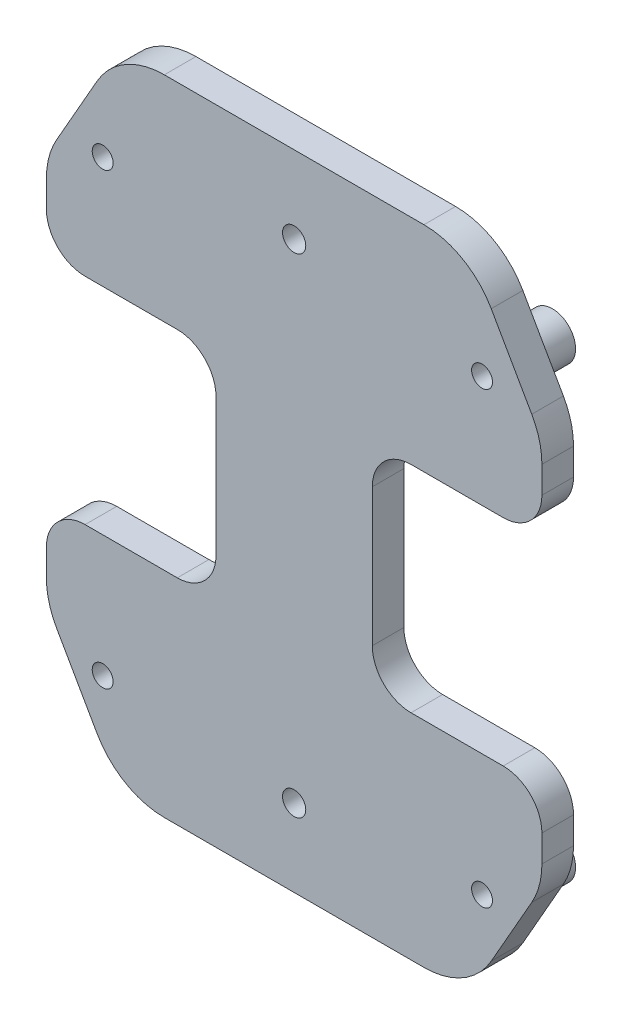
from build123d import *

# Parameters (mm, degrees)
IZIM1_R                     = 1.5
IZIM1_R_2                   = 1.275
Y_KSEKLIK_EKSTR_ZYON1_DEPTH = 8
IZIM2_R                     = 4
KES_EKSTR_ZYON1_DEPTH       = 5
IZIM3_R                     = 3.5
KES_EKSTR_ZYON2_DEPTH       = 5
IZIM5_W                     = 11.833700998
IZIM5_H                     = 5.687133077
Y_KSEKLIK_EKSTR_ZYON2_DEPTH = 55
IZIM6_R                     = 1.5
KES_EKSTR_ZYON3_DEPTH       = 70
Y_KSEKLIK_EKSTR_ZYON3_DEPTH = 10
KES_EKSTR_ZYON4_START       = -10
IZIM8_R                     = 1.5
KES_EKSTR_ZYON4_DEPTH       = 10
IZIM9_W                     = 97.77314617
IZIM9_H                     = 81.30293778
KES_EKSTR_ZYON5_DEPTH       = 94.5
IZIM10_R                    = 3
IZIM10_R_2                  = 1.35
Y_KSEKLIK_EKSTR_ZYON4_DEPTH = 5
IZIM12_R                    = 1.35
KES_EKSTR_ZYON6_DEPTH       = 11.5


with BuildPart() as part:
    # Çizim1 → Yükseklik-Ekstrüzyon1 (new body)
    with BuildSketch(Plane.XY):
        with BuildLine():
            Line((-26.942326891, 14.769848309), (-15.036455376, 14.769848309))
            ThreePointArc((-15.036455376, 14.769848309), (-11.50092147, 13.305382214), (-10.036455376, 9.769848309))
            Line((-10.036455376, 9.769848309), (-10.036455376, -8.006371062))
            ThreePointArc((-10.036455376, -8.006371062), (-11.50092147, -11.541904968), (-15.036455376, -13.006371062))
            Line((-15.036455376, -13.006371062), (-26.942326891, -13.006371062))
            ThreePointArc((-26.942326891, -13.006371062), (-30.477860797, -14.470837156), (-31.942326891, -18.006371062))
            Line((-31.942326891, -18.006371062), (-31.942326891, -21.470074229))
            ThreePointArc((-31.942326891, -21.470074229), (-31.6091093, -24.030019123), (-30.63166332, -26.419360282))
            Line((-30.63166332, -26.419360282), (-25.398075072, -35.607838889))
            ThreePointArc((-25.398075072, -35.607838889), (-21.734031643, -39.304154624), (-16.708738643, -40.658552836))
            Line((-16.708738643, -40.658552836), (16.824084861, -40.658552836))
            ThreePointArc((16.824084861, -40.658552836), (21.849377861, -39.304154624), (25.513421289, -35.607838889))
            Line((25.513421289, -35.607838889), (30.747009537, -26.419360282))
            ThreePointArc((30.747009537, -26.419360282), (31.724455518, -24.030019123), (32.057673109, -21.470074229))
            Line((32.057673109, -21.470074229), (32.057673109, -18.006371062))
            ThreePointArc((32.057673109, -18.006371062), (30.593207015, -14.470837156), (27.057673109, -13.006371062))
            Line((27.057673109, -13.006371062), (15.151801594, -13.006371062))
            ThreePointArc((15.151801594, -13.006371062), (11.616267688, -11.541904968), (10.151801594, -8.006371062))
            Line((10.151801594, -8.006371062), (10.151801594, 9.769848309))
            ThreePointArc((10.151801594, 9.769848309), (11.616267688, 13.305382214), (15.151801594, 14.769848309))
            Line((15.151801594, 14.769848309), (27.057673109, 14.769848309))
            ThreePointArc((27.057673109, 14.769848309), (30.593207015, 16.234314403), (32.057673109, 19.769848309))
            Line((32.057673109, 19.769848309), (32.057673109, 23.233551476))
            ThreePointArc((32.057673109, 23.233551476), (31.724455518, 25.793496369), (30.747009537, 28.182837528))
            Line((30.747009537, 28.182837528), (25.513421289, 37.371316135))
            ThreePointArc((25.513421289, 37.371316135), (21.849377861, 41.06763187), (16.824084861, 42.422030083))
            Line((16.824084861, 42.422030083), (-16.708738643, 42.422030083))
            ThreePointArc((-16.708738643, 42.422030083), (-21.734031643, 41.06763187), (-25.398075072, 37.371316135))
            Line((-25.398075072, 37.371316135), (-30.63166332, 28.182837528))
            ThreePointArc((-30.63166332, 28.182837528), (-31.6091093, 25.793496369), (-31.942326891, 23.233551476))
            Line((-31.942326891, 23.233551476), (-31.942326891, 19.769848309))
            ThreePointArc((-31.942326891, 19.769848309), (-30.477860797, 16.234314403), (-26.942326891, 14.769848309))
        make_face()
        with Locations((20.284256069, 32.422030083)):
            Circle(IZIM1_R, mode=Mode.SUBTRACT)
        with Locations((-20.168909852, 32.422030083)):
            Circle(IZIM1_R, mode=Mode.SUBTRACT)
        with Locations((-20.168909852, -30.658552836)):
            Circle(IZIM1_R, mode=Mode.SUBTRACT)
        with Locations((20.284256069, -30.658552836)):
            Circle(IZIM1_R, mode=Mode.SUBTRACT)
        with Locations((22.057673109, -21.118261377)):
            Circle(IZIM1_R_2, mode=Mode.SUBTRACT)
        with Locations((-21.942326891, -21.118261377)):
            Circle(IZIM1_R_2, mode=Mode.SUBTRACT)
        with Locations((22.057673109, 22.881738623)):
            Circle(IZIM1_R_2, mode=Mode.SUBTRACT)
        with Locations((-21.942326891, 22.881738623)):
            Circle(IZIM1_R_2, mode=Mode.SUBTRACT)
        with Locations((0.057673109, 32.422030083)):
            Circle(IZIM1_R, mode=Mode.SUBTRACT)
        with Locations(Location((0.057673109, -30.658552836, 0), (0, 0, 180))):
            Circle(IZIM1_R, mode=Mode.SUBTRACT)
    extrude(amount=Y_KSEKLIK_EKSTR_ZYON1_DEPTH)

    # Çizim2 → Kes-Ekstrüzyon1 (cut)
    with BuildSketch(Plane(origin=(0, 0, 0), x_dir=(-1, 0, 0), z_dir=(0, 0, -1))):
        with Locations((-22.057673109, 22.881738623)):
            Circle(IZIM2_R)
        with Locations((21.942326891, 22.881738623)):
            Circle(IZIM2_R)
        with Locations((-22.057673109, -21.118261377)):
            Circle(IZIM2_R)
        with Locations((21.942326891, -21.118261377)):
            Circle(IZIM2_R)
        with Locations((-0.057673109, 32.422030083)):
            Circle(IZIM2_R)
        with Locations((-0.057673109, -30.658552836)):
            Circle(IZIM2_R)
    extrude(amount=-KES_EKSTR_ZYON1_DEPTH, mode=Mode.SUBTRACT)

    # Çizim3 → Kes-Ekstrüzyon2 (cut)
    with BuildSketch(Plane.XY.offset(8)):
        with Locations((-20.168909852, 32.422030083)):
            Circle(IZIM3_R)
        with Locations((20.284256069, 32.422030083)):
            Circle(IZIM3_R)
        with Locations((20.284256069, -30.658552836)):
            Circle(IZIM3_R)
        with Locations((-20.168909852, -30.658552836)):
            Circle(IZIM3_R)
    extrude(amount=-KES_EKSTR_ZYON2_DEPTH, mode=Mode.SUBTRACT)

    # Çizim5 → Yükseklik-Ekstrüzyon2 (add)
    with BuildSketch(Plane.XY.offset(8)):
        with Locations((0.057673109, 32.422030083)):
            Rectangle(IZIM5_W, IZIM5_H)
        with Locations((0.057673109, -30.658552837)):
            Rectangle(IZIM5_W, IZIM5_H)
    extrude(amount=Y_KSEKLIK_EKSTR_ZYON2_DEPTH)

    # Çizim6 → Kes-Ekstrüzyon3 (cut)
    with BuildSketch(Plane(origin=(0, 0, 8), x_dir=(-1, 0, 0), z_dir=(0, 0, -1))):
        with Locations((-0.057673109, -30.658552836)):
            Circle(IZIM6_R)
        with Locations((-0.057673109, 32.422030083)):
            Circle(IZIM6_R)
    extrude(amount=-KES_EKSTR_ZYON3_DEPTH, mode=Mode.SUBTRACT)

    # Çizim7 → Yükseklik-Ekstrüzyon3 (add)
    with BuildSketch(Plane.XY.offset(63)):
        with BuildLine():
            Line((-31.942326891, 23.233551476), (-31.942326891, 19.769848309))
            ThreePointArc((-31.942326891, 19.769848309), (-30.477860797, 16.234314403), (-26.942326891, 14.769848309))
            Line((-26.942326891, 14.769848309), (-15.036455376, 14.769848309))
            ThreePointArc((-15.036455376, 14.769848309), (-11.50092147, 13.305382214), (-10.036455376, 9.769848309))
            Line((-10.036455376, 9.769848309), (-10.036455376, -8.006371062))
            ThreePointArc((-10.036455376, -8.006371062), (-11.50092147, -11.541904968), (-15.036455376, -13.006371062))
            Line((-15.036455376, -13.006371062), (-26.942326891, -13.006371062))
            ThreePointArc((-26.942326891, -13.006371062), (-30.477860797, -14.470837156), (-31.942326891, -18.006371062))
            Line((-31.942326891, -18.006371062), (-31.942326891, -21.470074229))
            ThreePointArc((-31.942326891, -21.470074229), (-31.6091093, -24.030019123), (-30.63166332, -26.419360282))
            Line((-30.63166332, -26.419360282), (-25.398075072, -35.607838889))
            ThreePointArc((-25.398075072, -35.607838889), (-21.734031643, -39.304154624), (-16.708738643, -40.658552836))
            Line((-16.708738643, -40.658552836), (16.824084861, -40.658552836))
            ThreePointArc((16.824084861, -40.658552836), (21.849377861, -39.304154624), (25.513421289, -35.607838889))
            Line((25.513421289, -35.607838889), (30.747009537, -26.419360282))
            ThreePointArc((30.747009537, -26.419360282), (31.724455518, -24.030019123), (32.057673109, -21.470074229))
            Line((32.057673109, -21.470074229), (32.057673109, -18.006371062))
            ThreePointArc((32.057673109, -18.006371062), (30.593207015, -14.470837156), (27.057673109, -13.006371062))
            Line((27.057673109, -13.006371062), (15.151801594, -13.006371062))
            ThreePointArc((15.151801594, -13.006371062), (11.616267688, -11.541904968), (10.151801594, -8.006371062))
            Line((10.151801594, -8.006371062), (10.151801594, 9.769848309))
            ThreePointArc((10.151801594, 9.769848309), (11.616267688, 13.305382214), (15.151801594, 14.769848309))
            Line((15.151801594, 14.769848309), (27.057673109, 14.769848309))
            ThreePointArc((27.057673109, 14.769848309), (30.593207015, 16.234314403), (32.057673109, 19.769848309))
            Line((32.057673109, 19.769848309), (32.057673109, 23.233551476))
            ThreePointArc((32.057673109, 23.233551476), (31.724455518, 25.793496369), (30.747009537, 28.182837528))
            Line((30.747009537, 28.182837528), (25.513421289, 37.371316135))
            ThreePointArc((25.513421289, 37.371316135), (21.849377861, 41.06763187), (16.824084861, 42.422030083))
            Line((16.824084861, 42.422030083), (-16.708738643, 42.422030083))
            ThreePointArc((-16.708738643, 42.422030083), (-21.734031643, 41.06763187), (-25.398075072, 37.371316135))
            Line((-25.398075072, 37.371316135), (-30.63166332, 28.182837528))
            ThreePointArc((-30.63166332, 28.182837528), (-31.6091093, 25.793496369), (-31.942326891, 23.233551476))
        make_face()
    extrude(amount=Y_KSEKLIK_EKSTR_ZYON3_DEPTH)

    # Çizim8 → Kes-Ekstrüzyon4 (cut)
    with BuildSketch(Plane.XY.offset(73).offset(KES_EKSTR_ZYON4_START)):
        with Locations(Location((0.057673109, -30.658552836, 0), (0, 0, 180))):
            Circle(IZIM8_R)
        with Locations(Location((0.057673109, 32.422030083, 0), (0, 0, 180))):
            Circle(IZIM8_R)
    extrude(amount=KES_EKSTR_ZYON4_DEPTH, mode=Mode.SUBTRACT)

    # Çizim9 → Kes-Ekstrüzyon5 (cut, symmetric)
    with BuildSketch(Plane(origin=(0, 35.265596621, 0), x_dir=(1, 0, 0), z_dir=(0, 1, 0))):
        with Locations((-4.059878989, -28.264895805)):
            Rectangle(IZIM9_W, IZIM9_H)
    extrude(amount=KES_EKSTR_ZYON5_DEPTH, both=True, mode=Mode.SUBTRACT)

    # Çizim10 → Yükseklik-Ekstrüzyon4 (add)
    # profile 1 of 4: a face of its own
    with BuildSketch(Plane(origin=(0, 0, 68.916364695), x_dir=(-1, 0, 0), z_dir=(0, 0, -1))):
        with Locations(Location((24.673182088, -28.763886305, 0), (0, 0, 180))):
            Circle(IZIM10_R)
        with Locations((24.673182088, -28.763886305)):
            Circle(IZIM10_R_2, mode=Mode.SUBTRACT)
    # profile 2 of 4: a face of its own
    with BuildSketch(Plane(origin=(0, 0, 68.916364695), x_dir=(-1, 0, 0), z_dir=(0, 0, -1))):
        with Locations(Location((-24.326817912, -28.763886305, 0), (0, 0, 180))):
            Circle(IZIM10_R)
        with Locations((-24.326817912, -28.763886305)):
            Circle(IZIM10_R_2, mode=Mode.SUBTRACT)
    # profile 3 of 4: a face of its own
    with BuildSketch(Plane(origin=(0, 0, 68.916364695), x_dir=(-1, 0, 0), z_dir=(0, 0, -1))):
        with Locations(Location((-24.326817912, 29.236113695, 0), (0, 0, 180))):
            Circle(IZIM10_R)
        with Locations((-24.326817912, 29.236113695)):
            Circle(IZIM10_R_2, mode=Mode.SUBTRACT)
    # profile 4 of 4: a face of its own
    with BuildSketch(Plane(origin=(0, 0, 68.916364695), x_dir=(-1, 0, 0), z_dir=(0, 0, -1))):
        with Locations(Location((24.673182088, 29.236113695, 0), (0, 0, 180))):
            Circle(IZIM10_R)
        with Locations((24.673182088, 29.236113695)):
            Circle(IZIM10_R_2, mode=Mode.SUBTRACT)
    extrude(amount=Y_KSEKLIK_EKSTR_ZYON4_DEPTH)

    # Çizim12 → Kes-Ekstrüzyon6 (cut, symmetric)
    with BuildSketch(Plane(origin=(0, 0, 68.916364695), x_dir=(-1, 0, 0), z_dir=(0, 0, -1))):
        with Locations(Location((-24.326817912, -28.763886305, 0), (0, 0, 180))):
            Circle(IZIM12_R)
        with Locations(Location((24.673182088, -28.763886305, 0), (0, 0, 180))):
            Circle(IZIM12_R)
        with Locations(Location((24.673182088, 29.236113695, 0), (0, 0, 180))):
            Circle(IZIM12_R)
        with Locations(Location((-24.326817912, 29.236113695, 0), (0, 0, 180))):
            Circle(IZIM12_R)
    extrude(amount=KES_EKSTR_ZYON6_DEPTH, both=True, mode=Mode.SUBTRACT)


solid = part.part
